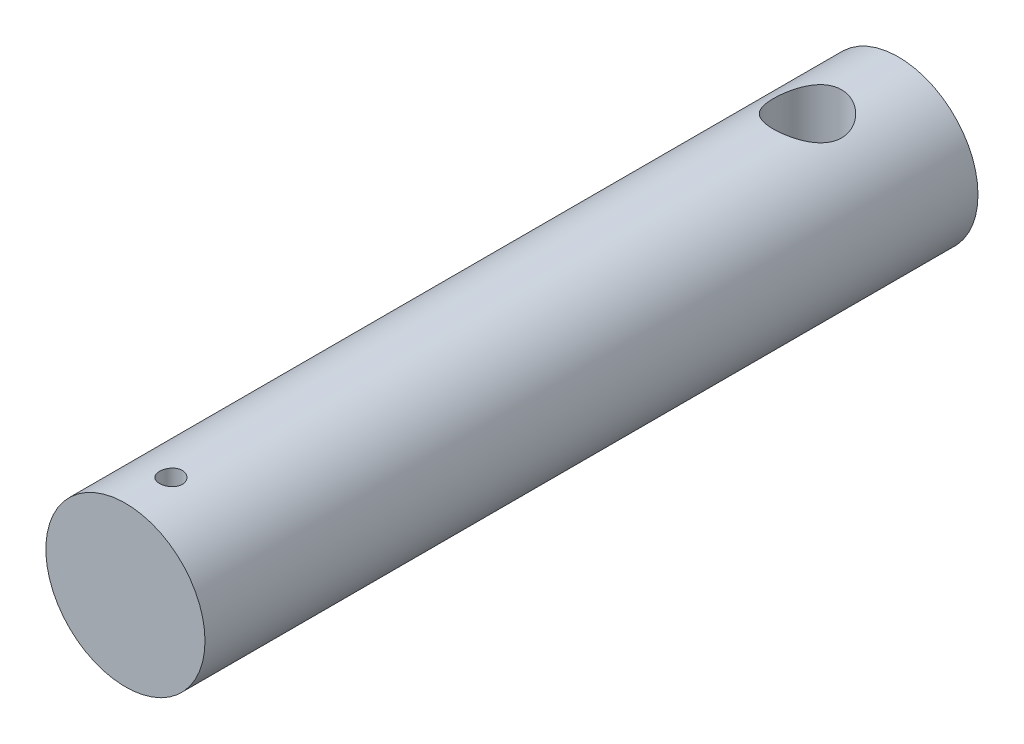
from build123d import *

# Parameters (mm, degrees)
SKETCH1_W               = 444.5
SKETCH1_H               = 4318
HOLE1_D                 = 381
CUT_EXTRUDE1_DEPTH      = 4364.517445942
CUT_EXTRUDE1_DEPTH_BACK = 4364.517445942
SKETCH4_R               = 63.5


with BuildPart() as part:
    # Sketch1 → Revolve1 (revolve)
    with BuildSketch(Plane(origin=(0, 0, 0), x_dir=(1, 0, 0), z_dir=(0, 1, 0))):
        with Locations((222.25, -2159)):
            Rectangle(SKETCH1_W, SKETCH1_H)
    revolve(axis=Axis((0, 0, 0), (0, 0, 1)))

    # Hole1 (through all)
    with Locations(Plane(origin=(0, 444.5, 508), x_dir=(1, 0, 0), z_dir=(0, 1, 0))):
        with Locations((0, 0)):
            Hole(HOLE1_D / 2)

    # Sketch4 → Cut-Extrude1 (cut, two sides: drawn at the far end of the back side and taken through both)
    with BuildSketch(Plane(origin=(0, 0, 0), x_dir=(1, 0, 0), z_dir=(0, 1, 0)).offset(-CUT_EXTRUDE1_DEPTH_BACK)):
        with Locations(Location((0, -4064, 0), (0, 0, 270))):
            Circle(SKETCH4_R)
    extrude(amount=CUT_EXTRUDE1_DEPTH + CUT_EXTRUDE1_DEPTH_BACK, mode=Mode.SUBTRACT)


solid = part.part
